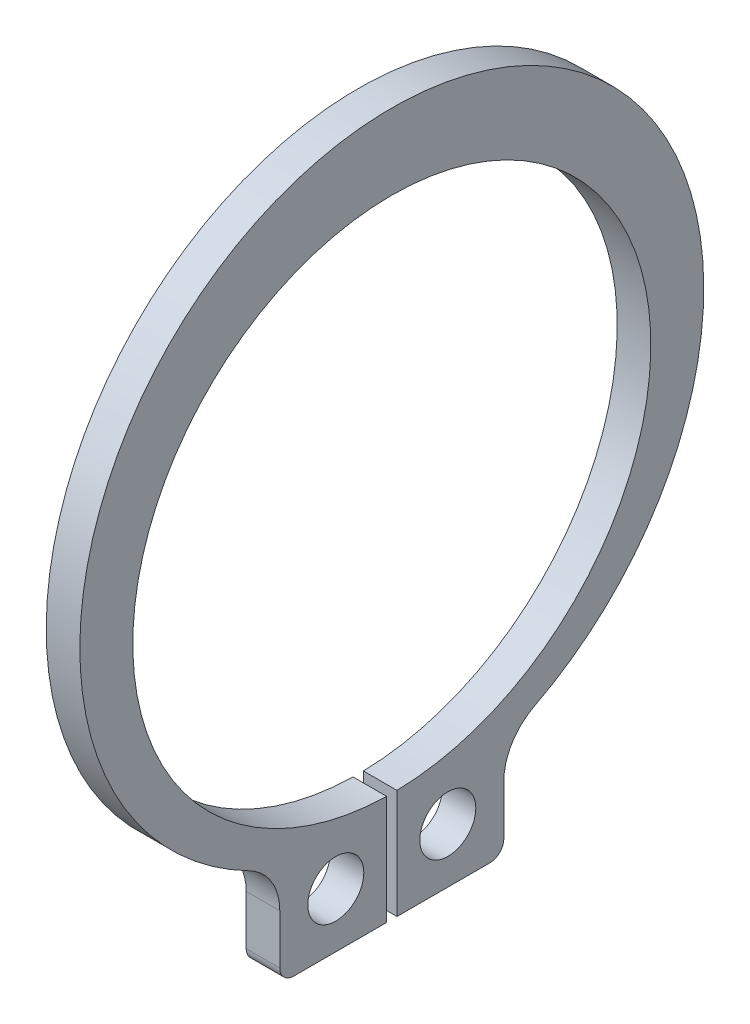
from build123d import *

# Parameters (mm, degrees)
EXTRUDE_1_DEPTH      = 0.6
EXTRUDE_1_DEPTH_BACK = 0.6
SKETCH_1_R           = 1


with BuildPart() as part:
    # 草圖1 → 填料-伸長1 (new, two sides: drawn at the far end of the back side and taken through both)
    with BuildSketch(Plane(origin=(0, 0, 0), x_dir=(0, 0, -1), z_dir=(1, 0, 0)).offset(-EXTRUDE_1_DEPTH_BACK)):
        with BuildLine():
            Line((-4, -10.8801497), (-4, -12.65))
            ThreePointArc((-4, -12.65), (-3.853553391, -13.003553391), (-3.5, -13.15))
            Line((-3.5, -13.15), (-0.185, -13.15))
            Line((-0.185, -13.15), (-0.185, -9.248149815))
            ThreePointArc((-0.185, -9.248149815), (0, 9.25), (0.185, -9.248149815))
            Line((0.185, -9.248149815), (0.185, -13.15))
            Line((0.185, -13.15), (3.5, -13.15))
            ThreePointArc((3.5, -13.15), (3.853553391, -13.003553391), (4, -12.65))
            Line((4, -12.65), (4, -10.8801497))
            ThreePointArc((4, -10.8801497), (4.293177827, -9.837672808), (5.08675807, -9.100827026))
            ThreePointArc((5.08675807, -9.100827026), (5.9e-08, 11.95), (-5.086758175, -9.100826972))
            ThreePointArc((-5.086758175, -9.100826972), (-4.293177858, -9.837672758), (-4, -10.8801497))
        make_face()
        with Locations((2, -11.2)):
            Circle(SKETCH_1_R, mode=Mode.SUBTRACT)
        with Locations((-2, -11.2)):
            Circle(SKETCH_1_R, mode=Mode.SUBTRACT)
    extrude(amount=EXTRUDE_1_DEPTH + EXTRUDE_1_DEPTH_BACK)


solid = part.part
